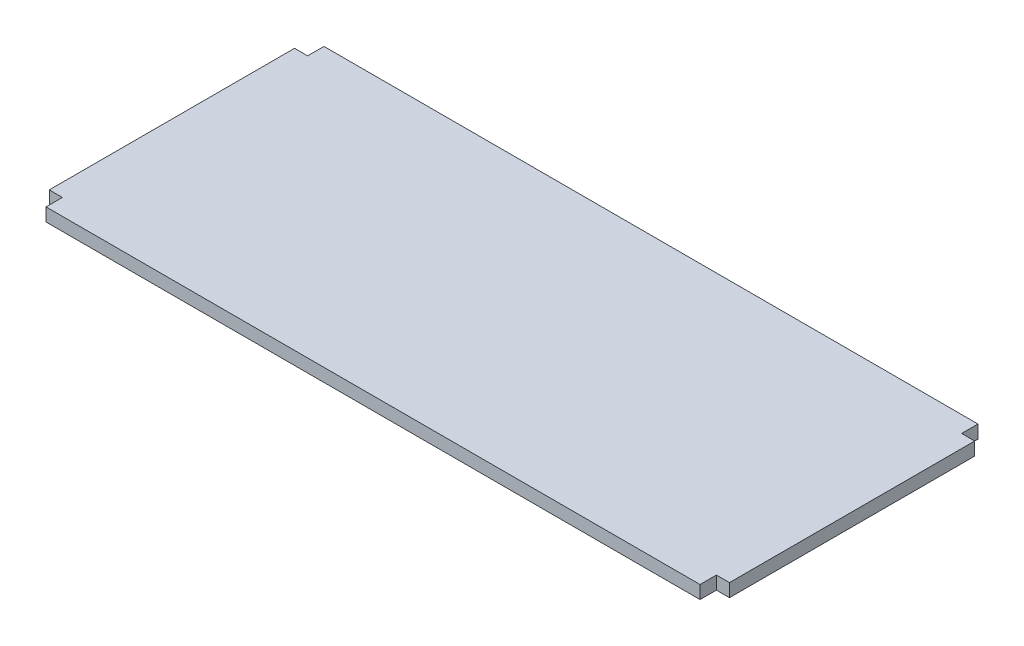
from build123d import *

# Parameters (mm, degrees)
SKETCH_1_W      = 2
SKETCH_1_H      = 37.5
SKETCH_1_W_2    = 100
SKETCH_1_H_2    = 42.5
EXTRUDE_1_DEPTH = 2


with BuildPart() as part:
    # 草图1 → 凸台-拉伸1 (new body)
    with BuildSketch(Plane(origin=(0, 0, 0), x_dir=(1, 0, 0), z_dir=(0, 1, 0))):
        with Locations((-1, 21.25)):
            Rectangle(SKETCH_1_W, SKETCH_1_H)
        with Locations((50, 21.25)):
            Rectangle(SKETCH_1_W_2, SKETCH_1_H_2)
        with Locations((101, 21.25)):
            Rectangle(SKETCH_1_W, SKETCH_1_H)
    extrude(amount=EXTRUDE_1_DEPTH)


solid = part.part
